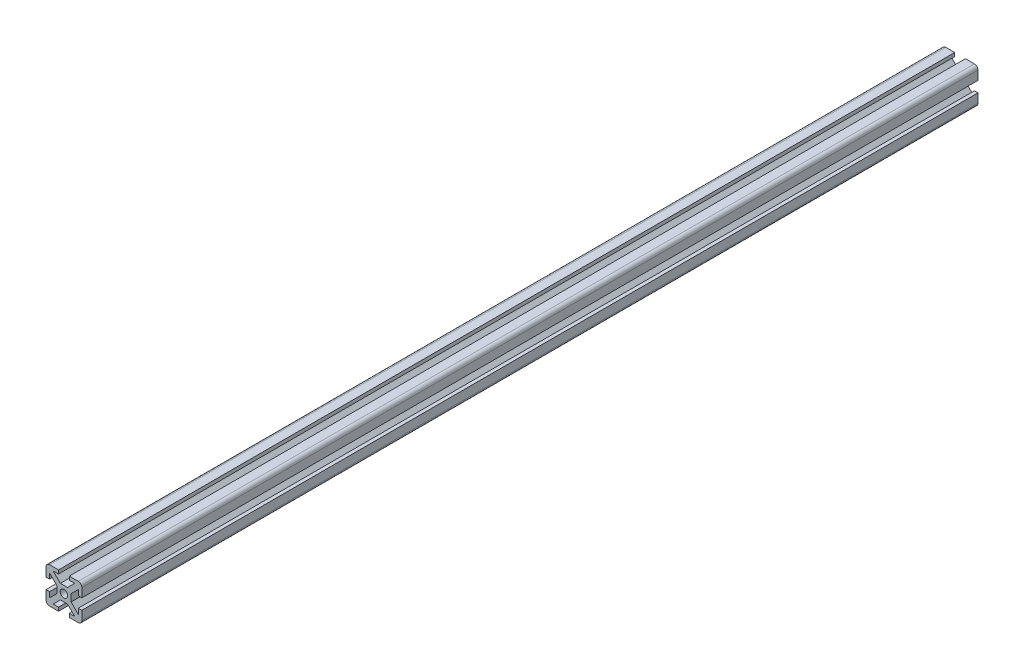
from build123d import *

# Parameters (mm, degrees)
SKETCH1_R           = 2.1
BOSS_EXTRUDE1_DEPTH = 500


with BuildPart() as part:
    # Sketch1 → Boss-Extrude1 (new body)
    with BuildSketch(Plane.XY):
        with BuildLine():
            Line((-2, -4), (2, -4))
            Line((2, -4), (6, -8))
            Line((6, -8), (3, -8))
            Line((3, -8), (3, -10))
            Line((3, -10), (8, -10))
            ThreePointArc((8, -10), (9.414213562, -9.414213562), (10, -8))
            Line((10, -8), (10, -3))
            Line((10, -3), (8, -3))
            Line((8, -3), (8, -6))
            Line((8, -6), (4, -2))
            Line((4, -2), (4, 2))
            Line((4, 2), (8, 6))
            Line((8, 6), (8, 3))
            Line((8, 3), (10, 3))
            Line((10, 3), (10, 8))
            ThreePointArc((10, 8), (9.414213562, 9.414213562), (8, 10))
            Line((8, 10), (3, 10))
            Line((3, 10), (3, 8))
            Line((3, 8), (6, 8))
            Line((6, 8), (2, 4))
            Line((2, 4), (-2, 4))
            Line((-2, 4), (-6, 8))
            Line((-6, 8), (-3, 8))
            Line((-3, 8), (-3, 10))
            Line((-3, 10), (-8, 10))
            ThreePointArc((-8, 10), (-9.414213562, 9.414213562), (-10, 8))
            Line((-10, 8), (-10, 3))
            Line((-10, 3), (-8, 3))
            Line((-8, 3), (-8, 6))
            Line((-8, 6), (-4, 2))
            Line((-4, 2), (-4, -2))
            Line((-4, -2), (-8, -6))
            Line((-8, -6), (-8, -3))
            Line((-8, -3), (-10, -3))
            Line((-10, -3), (-10, -8))
            ThreePointArc((-10, -8), (-9.414213562, -9.414213562), (-8, -10))
            Line((-8, -10), (-3, -10))
            Line((-3, -10), (-3, -8))
            Line((-3, -8), (-6, -8))
            Line((-6, -8), (-2, -4))
        make_face()
        Circle(SKETCH1_R, mode=Mode.SUBTRACT)
    extrude(amount=BOSS_EXTRUDE1_DEPTH)


solid = part.part
